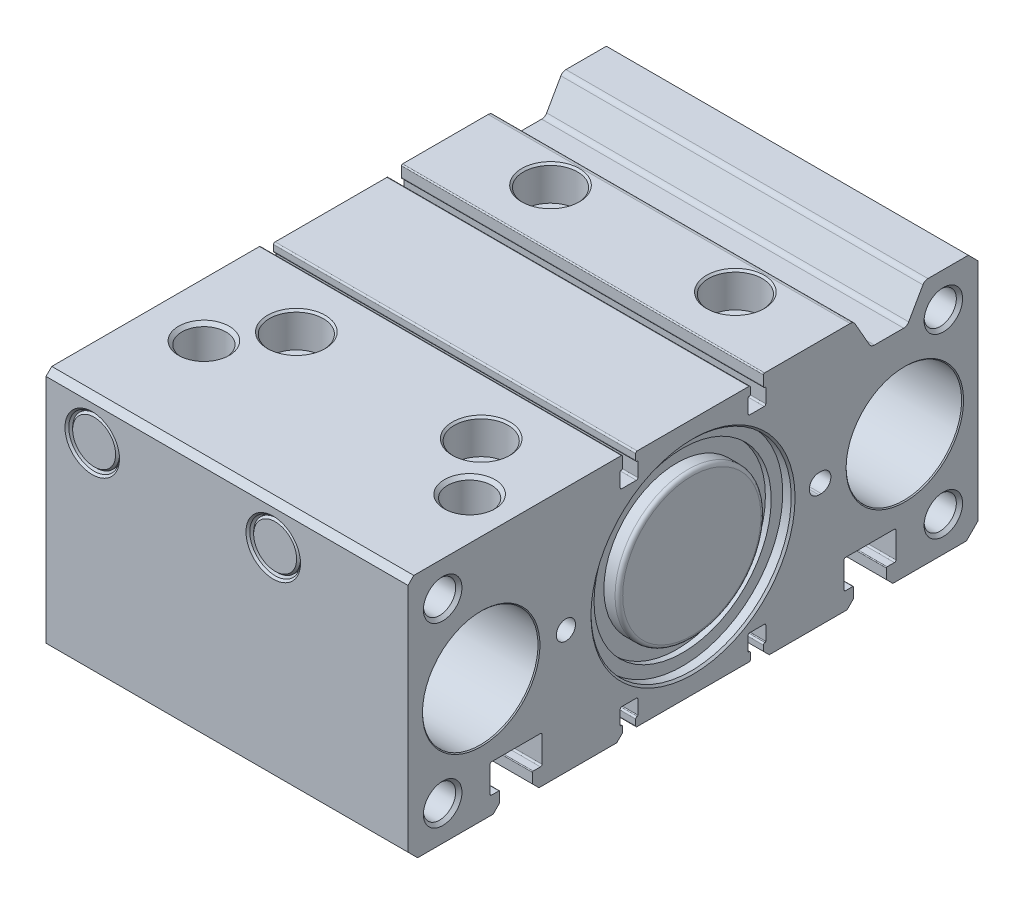
from build123d import *

# Parameters (mm, degrees)
EXTRUDE_1_DEPTH             = 94
PATTERN_LINEAR_1_COUNT      = 2
PATTERN_LINEAR_1_PITCH      = 48
PATTERN_LINEAR_1_COUNT_DIR2 = 2
PATTERN_LINEAR_1_PITCH_DIR2 = 66
HOLE_WIZARD_1_D             = 11.445
HOLE_WIZARD_1_DEPTH         = 13.05
HOLE_WIZARD_1_CSINK_D       = 13.157
HOLE_WIZARD_1_CSINK_ANGLE   = 90
HOLE_WIZARD_2_D             = 11.445
HOLE_WIZARD_2_DEPTH         = 13.05
HOLE_WIZARD_2_CSINK_D       = 13.157
HOLE_WIZARD_2_CSINK_ANGLE   = 90
SKETCH_16_W                 = 2.5
SKETCH_16_H                 = 8
PATTERN_LINEAR_2_COUNT      = 2
PATTERN_LINEAR_2_PITCH      = 130
PATTERN_LINEAR_2_COUNT_DIR2 = 2
PATTERN_LINEAR_2_PITCH_DIR2 = 46
HOLE_WIZARD_4_D             = 5
HOLE_WIZARD_4_DEPTH         = 8
HOLE_WIZARD_5_D             = 5
HOLE_WIZARD_5_DEPTH         = 8
HOLE_WIZARD_5_TIP           = 1.443375673
CUT_EXTRUDE_1_DEPTH         = 4
CUT_EXTRUDE_2_DEPTH         = 4


with BuildPart() as part:
    # 草图1 → 凸台-拉伸1 (new body)
    with BuildSketch(Plane(origin=(0, 0, 0), x_dir=(0, 0, -1), z_dir=(1, 0, 0))):
        with BuildLine():
            Line((-74, 30.5), (-74, -29.5))
            Line((-74, -29.5), (-71.5, -32))
            Line((-71.5, -32), (-51.9, -32))
            Line((-51.9, -32), (-50.2, -30.3))
            Line((-50.2, -30.3), (-50.2, -27.7))
            ThreePointArc((-50.2, -27.7), (-50.258578644, -27.558578644), (-50.4, -27.5))
            Line((-50.4, -27.5), (-52.3, -27.5))
            ThreePointArc((-52.3, -27.5), (-52.582842712, -27.382842712), (-52.7, -27.1))
            Line((-52.7, -27.1), (-52.7, -20.4))
            ThreePointArc((-52.7, -20.4), (-52.582842712, -20.117157288), (-52.3, -20))
            Line((-52.3, -20), (-39.6, -20))
            ThreePointArc((-39.6, -20), (-39.317157288, -20.117157288), (-39.2, -20.4))
            Line((-39.2, -20.4), (-39.2, -27.1))
            ThreePointArc((-39.2, -27.1), (-39.317157288, -27.382842712), (-39.6, -27.5))
            Line((-39.6, -27.5), (-41.5, -27.5))
            ThreePointArc((-41.5, -27.5), (-41.641421356, -27.558578644), (-41.7, -27.7))
            Line((-41.7, -27.7), (-41.7, -30.3))
            Line((-41.7, -30.3), (-40, -32))
            Line((-40, -32), (-19.8, -32))
            Line((-19.8, -32), (-18.3, -30.5))
            Line((-18.3, -30.5), (-18.3, -29.1))
            ThreePointArc((-18.3, -29.1), (-18.417157305, -28.81715727), (-18.70000005, -28.7))
            ThreePointArc((-18.70000005, -28.7), (-18.841421374, -28.641421339), (-18.9, -28.5))
            Line((-18.9, -28.5), (-18.9, -24.9))
            ThreePointArc((-18.9, -24.9), (-18.782842712, -24.617157288), (-18.5, -24.5))
            Line((-18.5, -24.5), (-14.7, -24.5))
            ThreePointArc((-14.7, -24.5), (-14.417157288, -24.617157288), (-14.3, -24.9))
            Line((-14.3, -24.9), (-14.3, -28.5))
            ThreePointArc((-14.3, -28.5), (-14.358578661, -28.641421374), (-14.50000005, -28.7))
            ThreePointArc((-14.50000005, -28.7), (-14.78284273, -28.817157305), (-14.9, -29.1))
            Line((-14.9, -29.1), (-14.9, -30.6))
            ThreePointArc((-14.9, -30.6), (-14.782842712, -30.882842712), (-14.5, -31))
            Line((-14.5, -31), (14.5, -31))
            ThreePointArc((14.5, -31), (14.782842712, -30.882842712), (14.9, -30.6))
            Line((14.9, -30.6), (14.9, -29.1))
            ThreePointArc((14.9, -29.1), (14.782842704, -28.817157279), (14.499999976, -28.7))
            ThreePointArc((14.499999976, -28.7), (14.358578635, -28.641421348), (14.3, -28.5))
            Line((14.3, -28.5), (14.3, -24.9))
            ThreePointArc((14.3, -24.9), (14.417157288, -24.617157288), (14.7, -24.5))
            Line((14.7, -24.5), (18.5, -24.5))
            ThreePointArc((18.5, -24.5), (18.782842712, -24.617157288), (18.9, -24.9))
            Line((18.9, -24.9), (18.9, -28.5))
            ThreePointArc((18.9, -28.5), (18.841421365, -28.641421348), (18.700000024, -28.7))
            ThreePointArc((18.700000024, -28.7), (18.417157296, -28.817157279), (18.3, -29.1))
            Line((18.3, -29.1), (18.3, -30.5))
            Line((18.3, -30.5), (19.8, -32))
            Line((19.8, -32), (40, -32))
            Line((40, -32), (41.7, -30.3))
            Line((41.7, -30.3), (41.7, -27.7))
            ThreePointArc((41.7, -27.7), (41.641421356, -27.558578644), (41.5, -27.5))
            Line((41.5, -27.5), (39.6, -27.5))
            ThreePointArc((39.6, -27.5), (39.317157288, -27.382842712), (39.2, -27.1))
            Line((39.2, -27.1), (39.2, -20.4))
            ThreePointArc((39.2, -20.4), (39.317157288, -20.117157288), (39.6, -20))
            Line((39.6, -20), (52.3, -20))
            ThreePointArc((52.3, -20), (52.582842712, -20.117157288), (52.7, -20.4))
            Line((52.7, -20.4), (52.7, -27.1))
            ThreePointArc((52.7, -27.1), (52.582842712, -27.382842712), (52.3, -27.5))
            Line((52.3, -27.5), (50.4, -27.5))
            ThreePointArc((50.4, -27.5), (50.258578644, -27.558578644), (50.2, -27.7))
            Line((50.2, -27.7), (50.2, -30.3))
            Line((50.2, -30.3), (51.9, -32))
            Line((51.9, -32), (71, -32))
            Line((71, -32), (74, -29))
            Line((74, -29), (74, 29.5))
            Line((74, 29.5), (71.5, 32))
            Line((71.5, 32), (61, 32))
            ThreePointArc((61, 32), (60.246174677, 31.796822032), (59.696563617, 31.242329843))
            Line((59.696563617, 31.242329843), (56.003436383, 24.757670157))
            ThreePointArc((56.003436383, 24.757670157), (55.453825323, 24.203177968), (54.7, 24))
            Line((54.7, 24), (47.1, 24))
            ThreePointArc((47.1, 24), (46.346174677, 24.203177968), (45.796563617, 24.757670157))
            Line((45.796563617, 24.757670157), (42.103436383, 31.242329843))
            ThreePointArc((42.103436383, 31.242329843), (41.553825323, 31.796822032), (40.8, 32))
            Line((40.8, 32), (18.6, 32))
            ThreePointArc((18.6, 32), (18.387867966, 31.912132034), (18.3, 31.7))
            Line((18.3, 31.7), (18.3, 29.1))
            ThreePointArc((18.3, 29.1), (18.417157296, 28.817157279), (18.700000024, 28.7))
            ThreePointArc((18.700000024, 28.7), (18.841421365, 28.641421348), (18.9, 28.5))
            Line((18.9, 28.5), (18.9, 24.9))
            ThreePointArc((18.9, 24.9), (18.782842712, 24.617157288), (18.5, 24.5))
            Line((18.5, 24.5), (14.7, 24.5))
            ThreePointArc((14.7, 24.5), (14.417157288, 24.617157288), (14.3, 24.9))
            Line((14.3, 24.9), (14.3, 28.5))
            ThreePointArc((14.3, 28.5), (14.358578652, 28.641421365), (14.500000024, 28.7))
            ThreePointArc((14.500000024, 28.7), (14.782842721, 28.817157296), (14.9, 29.1))
            Line((14.9, 29.1), (14.9, 30.6))
            ThreePointArc((14.9, 30.6), (14.782842712, 30.882842712), (14.5, 31))
            Line((14.5, 31), (-14.5, 31))
            ThreePointArc((-14.5, 31), (-14.782842712, 30.882842712), (-14.9, 30.6))
            Line((-14.9, 30.6), (-14.9, 29.1))
            ThreePointArc((-14.9, 29.1), (-14.782842695, 28.81715727), (-14.49999995, 28.7))
            ThreePointArc((-14.49999995, 28.7), (-14.358578626, 28.641421339), (-14.3, 28.5))
            Line((-14.3, 28.5), (-14.3, 24.9))
            ThreePointArc((-14.3, 24.9), (-14.417157288, 24.617157288), (-14.7, 24.5))
            Line((-14.7, 24.5), (-18.5, 24.5))
            ThreePointArc((-18.5, 24.5), (-18.782842712, 24.617157288), (-18.9, 24.9))
            Line((-18.9, 24.9), (-18.9, 28.5))
            ThreePointArc((-18.9, 28.5), (-18.841421374, 28.641421339), (-18.70000005, 28.7))
            ThreePointArc((-18.70000005, 28.7), (-18.417157305, 28.81715727), (-18.3, 29.1))
            Line((-18.3, 29.1), (-18.3, 31.7))
            ThreePointArc((-18.3, 31.7), (-18.387867966, 31.912132034), (-18.6, 32))
            Line((-18.6, 32), (-72.5, 32))
            Line((-72.5, 32), (-74, 30.5))
        make_face()
    extrude(amount=EXTRUDE_1_DEPTH)

    # 草图2 → 切除-旋转1 (revolve, cut)
    with BuildSketch(Plane.XY.offset(33)):
        Polygon((24, 32), (31.5, 32), (31, 31.5), (31, 23), (28.25, 23), (28.25, -13), (29, -13), (28.188, -13.812), (28.188, -32.188), (29, -33), (24, -33), align=None)
    cut_revolve_1 = revolve(axis=Axis((24, -33, 33), (0, 1, 0)), mode=Mode.SUBTRACT)

    # 阵列(线性)1: Cut-Revolve 1 2 × 2
    with Locations(*[(i * PATTERN_LINEAR_1_PITCH, 0, -j * PATTERN_LINEAR_1_PITCH_DIR2) for i in range(PATTERN_LINEAR_1_COUNT) for j in range(PATTERN_LINEAR_1_COUNT_DIR2) if (i, j) != (0, 0)]):
        add(cut_revolve_1, mode=Mode.SUBTRACT)

    # 草图4 → 切除-旋转2 (revolve, cut)
    with BuildSketch(Plane.XY.offset(55)):
        Polygon((0, 0), (0, 16.25), (0.25, 16), (1.5, 16), (1.5, 10), (20, 10), (20, 15), (93.75, 15), (94, 15.25), (94, 0), align=None)
    revolve(axis=Axis((94, 0, 55), (-1, 0, 0)), mode=Mode.SUBTRACT)

    # 草图5 → 切除-旋转3 (revolve, cut)
    with BuildSketch(Plane.XY.offset(-55)):
        Polygon((0, 0), (0, 16.25), (0.25, 16), (1.5, 16), (1.5, 10), (20, 10), (20, 15), (93.75, 15), (94, 15.25), (94, 0), align=None)
    revolve(axis=Axis((94, 0, -55), (-1, 0, 0)), mode=Mode.SUBTRACT)

    # 草图6 → 切除-旋转4 (revolve, cut)
    with BuildSketch(Plane.XY):
        Polygon((0, 0), (0, 26.25), (0.25, 26), (2.7, 26), (2.7, 23), (4.2, 23), (4.2, 10), (16.4, 10), (16.4, 25), (88, 25), (88, 0), align=None)
    revolve(axis=Axis((88, 0, 0), (-1, 0, 0)), mode=Mode.SUBTRACT)

    # 草图7 → 切除-旋转5 (revolve, cut)
    with BuildSketch(Plane.XY):
        Polygon((89.8, 0), (89.8, 23), (91.3, 23), (91.3, 26), (93.5, 26), (94, 26.5), (94, 0), align=None)
    revolve(axis=Axis((94, 0, 0), (-1, 0, 0)), mode=Mode.SUBTRACT)

    # 草图8 → 旋转1 (revolve)
    with BuildSketch(Plane.XY):
        with BuildLine():
            Line((89.8, 0), (89.8, 18.95))
            Line((89.8, 18.95), (92.7, 18.95))
            ThreePointArc((92.7, 18.95), (93.407106781, 18.657106781), (93.7, 17.95))
            Line((93.7, 17.95), (93.7, 0))
            Line((93.7, 0), (89.8, 0))
        make_face()
    revolve(axis=Axis((93.7, 0, 0), (-1, 0, 0)))

    # 草图9 → 旋转2 (revolve)
    with BuildSketch(Plane.XY):
        with BuildLine():
            Line((0.3, 10), (5.3, 10))
            Line((5.3, 10), (5.3, 18.95))
            Line((5.3, 18.95), (1.05, 18.95))
            ThreePointArc((1.05, 18.95), (0.519669914, 18.730330086), (0.3, 18.2))
            Line((0.3, 18.2), (0.3, 10))
        make_face()
    revolve(axis=Axis((5.3, 0, 0), (-1, 0, 0)))

    # 孔1
    with Locations(Plane(origin=(0, 32, 0), x_dir=(1, 0, 0), z_dir=(0, 1, 0))):
        with Locations((14, -47)):
            CounterSinkHole(HOLE_WIZARD_1_D / 2, HOLE_WIZARD_1_CSINK_D / 2, depth=HOLE_WIZARD_1_DEPTH, counter_sink_angle=HOLE_WIZARD_1_CSINK_ANGLE)

    # 孔2
    with Locations(Plane(origin=(0, 32, 0), x_dir=(1, 0, 0), z_dir=(0, 1, 0))):
        with Locations((83, -47)):
            CounterSinkHole(HOLE_WIZARD_2_D / 2, HOLE_WIZARD_2_CSINK_D / 2, depth=HOLE_WIZARD_2_DEPTH, counter_sink_angle=HOLE_WIZARD_2_CSINK_ANGLE)

    # 草图14 → 切除-旋转6 (revolve, cut)
    with BuildSketch(Plane(origin=(12, 0, 0), x_dir=(0, 0, -1), z_dir=(1, 0, 0))):
        Polygon((-74, 21.5), (-74, 28.5785), (-73.5, 28.0785), (-69.5, 28.0785), (-69.5, 27.5785), (-73, 27.5785), (-73.5, 27.0785), (-73.5, 21.5), align=None)
    revolve(axis=Axis((12, 21.5, 69.5), (0, 0, 1)), mode=Mode.SUBTRACT)

    # 草图15 → 切除-旋转7 (revolve, cut)
    with BuildSketch(Plane(origin=(59, 0, 0), x_dir=(0, 0, -1), z_dir=(1, 0, 0))):
        Polygon((-74, 21.5), (-74, 28.5785), (-73.5, 28.0785), (-69.5, 28.0785), (-69.5, 27.5785), (-73, 27.5785), (-73.5, 27.0785), (-73.5, 21.5), align=None)
    revolve(axis=Axis((59, 21.5, 69.5), (0, 0, 1)), mode=Mode.SUBTRACT)

    # 草图16 → 切除-旋转8 (revolve, cut)
    with BuildSketch(Plane.XY.offset(33)):
        with Locations((49.25, -29)):
            Rectangle(SKETCH_16_W, SKETCH_16_H)
    revolve(axis=Axis((48, -33, 33), (0, 1, 0)), mode=Mode.SUBTRACT)

    # 草图17 → 切除-旋转9 (revolve, cut)
    with BuildSketch(Plane.XY.offset(-33)):
        Polygon((48, -23.556624327), (50.5, -25), (50.5, -33), (48, -33), align=None)
    revolve(axis=Axis((48, -33, -33), (0, 1, 0)), mode=Mode.SUBTRACT)

    # 草图18 → 孔3 (revolve, cut)
    with BuildSketch(Plane(origin=(94, -23, 65), x_dir=(0, 0, -1), z_dir=(0, 1, 0))):
        Polygon((0, 0), (0, 28.817942927), (4.188, 26.4), (4.188, 0.812), (5, 0), align=None)
    hole_wizard_3 = revolve(axis=Axis((108.308894879, -23, 65), (-1, 0, 0)), mode=Mode.SUBTRACT)

    # 阵列(线性)2: Hole Wizard 3 2 × 2
    with Locations(*[(0, j * PATTERN_LINEAR_2_PITCH_DIR2, -i * PATTERN_LINEAR_2_PITCH) for i in range(PATTERN_LINEAR_2_COUNT) for j in range(PATTERN_LINEAR_2_COUNT_DIR2) if (i, j) != (0, 0)]):
        add(hole_wizard_3, mode=Mode.SUBTRACT)

    # 孔4
    with Locations(Plane(origin=(94, 0, 0), x_dir=(0, 0, -1), z_dir=(1, 0, 0))):
        with Locations((-33, 0)):
            Hole(HOLE_WIZARD_4_D / 2, depth=HOLE_WIZARD_4_DEPTH)

    # 孔5
    with Locations(Plane(origin=(94, 0, 0), x_dir=(0, 0, -1), z_dir=(1, 0, 0))):
        with Locations((33, 0)):
            Hole(HOLE_WIZARD_5_D / 2, depth=HOLE_WIZARD_5_DEPTH)
            with Locations((0, 0, -(HOLE_WIZARD_5_DEPTH + HOLE_WIZARD_5_TIP / 2))):  # 120° drill point
                Cone(0, HOLE_WIZARD_5_D / 2, HOLE_WIZARD_5_TIP, mode=Mode.SUBTRACT)

    # 草图25 → 切除-拉伸1 (cut)
    with BuildSketch(Plane(origin=(0, -32, 0), x_dir=(1, 0, 0), z_dir=(0, 1, 0))):
        with BuildLine():
            Line((50.5, 32.7), (50.5, 33.3))
            ThreePointArc((50.5, 33.3), (48, 35.8), (45.5, 33.3))
            Line((45.5, 33.3), (45.5, 32.7))
            ThreePointArc((45.5, 32.7), (48, 30.2), (50.5, 32.7))
        make_face()
    extrude(amount=CUT_EXTRUDE_1_DEPTH, mode=Mode.SUBTRACT)

    # 草图26 → 切除-拉伸2 (cut)
    with BuildSketch(Plane(origin=(94, 0, 0), x_dir=(0, 0, -1), z_dir=(1, 0, 0))):
        with BuildLine():
            Line((32.7, -2.5), (33.3, -2.5))
            ThreePointArc((33.3, -2.5), (35.8, 0), (33.3, 2.5))
            Line((33.3, 2.5), (32.7, 2.5))
            ThreePointArc((32.7, 2.5), (30.2, 0), (32.7, -2.5))
        make_face()
    extrude(amount=-CUT_EXTRUDE_2_DEPTH, mode=Mode.SUBTRACT)


solid = part.part
